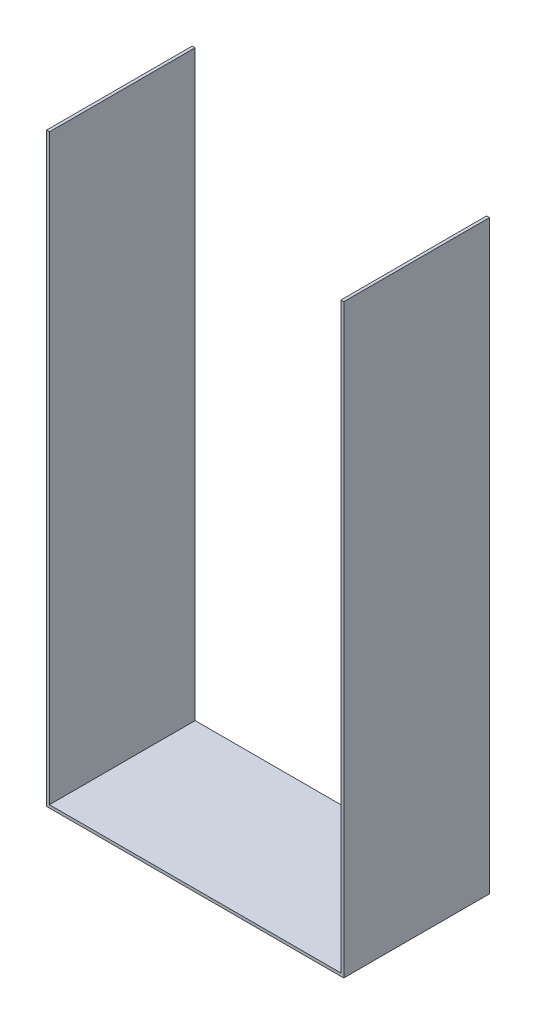
from build123d import *

# Parameters (mm, degrees)
BOSS_EXTRUDE1_DEPTH = 10000


with BuildPart() as part:
    # Sketch2 → Boss-Extrude1 (new body)
    with BuildSketch(Plane.XY):
        Polygon((0, 0), (0, -40000), (20000, -40000), (20000, 0), (20200, 0), (20200, -40200), (-200, -40200), (-200, 0), align=None)
    extrude(amount=-BOSS_EXTRUDE1_DEPTH)


solid = part.part
